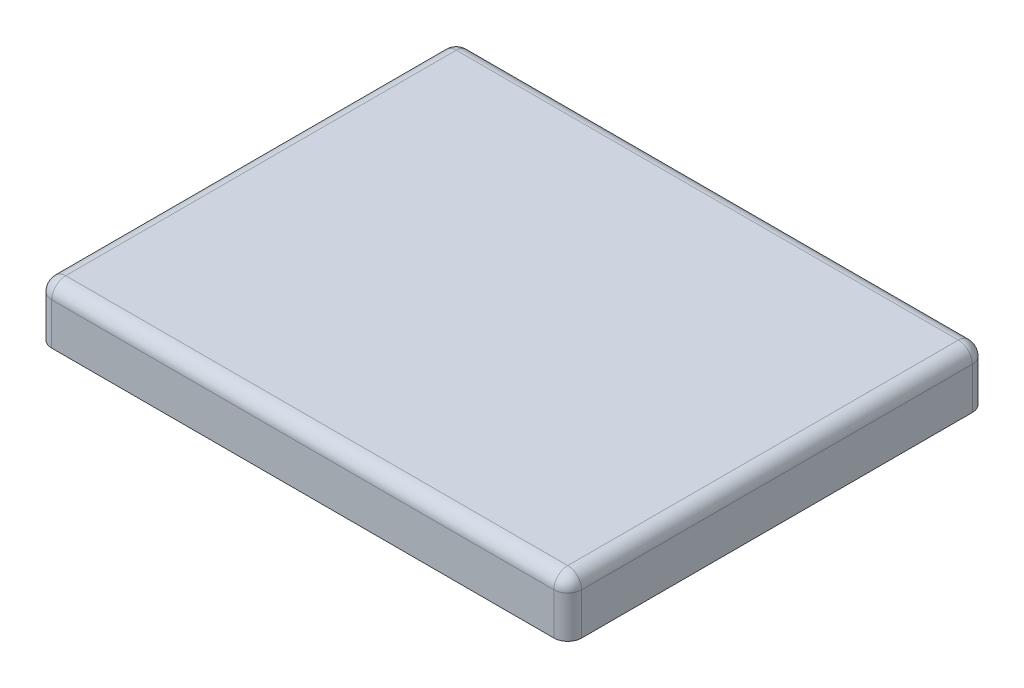
from build123d import *

# Parameters (mm, degrees)
SKETCH1_W           = 482.6
SKETCH1_H           = 381
BOSS_EXTRUDE1_DEPTH = 50.8
FILLET1_R           = 12.7


with BuildPart() as part:
    # Sketch1 → Boss-Extrude1 (new body)
    with BuildSketch(Plane(origin=(0, 0, 0), x_dir=(1, 0, 0), z_dir=(0, 1, 0))):
        with Locations((241.3, 190.5)):
            Rectangle(SKETCH1_W, SKETCH1_H)
    extrude(amount=BOSS_EXTRUDE1_DEPTH)

    # Fillet1
    fillet1_edges = [part.edges().sort_by_distance(p)[0] for p in [
        (482.6, 50.8, -190.5),
        (241.3, 50.8, -381),
        (0, 50.8, -190.5),
        (241.3, 50.8, 0),
        (0, 25.4, -381),
        (482.6, 25.4, -381),
        (482.6, 25.4, 0),
        (0, 25.4, 0),
    ]]
    fillet(fillet1_edges, radius=FILLET1_R)


solid = part.part
